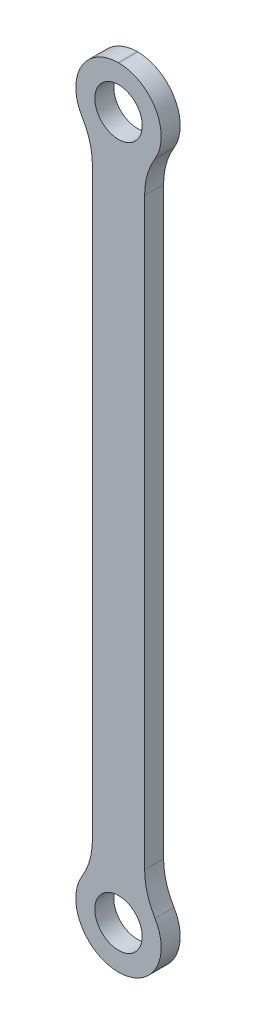
from build123d import *

# Parameters (mm, degrees)
SKETCH_1_R      = 5
EXTRUDE_1_DEPTH = 4


with BuildPart() as part:
    # 草图1 → 凸台-拉伸1 (new body)
    with BuildSketch(Plane.XY):
        with BuildLine():
            Line((-5.5, 135.520010959), (-5.5, 12.479983974))
            ThreePointArc((-5.5, 12.479983974), (-6.05722499, 8.429521038), (-7.6875, 4.67999399))
            ThreePointArc((-7.6875, 4.67999399), (-7.870390208, -4.365427582), (-0.099998457, -8.999444444))
            Line((-0.099998457, -8.999444444), (0.099998457, -8.999444444))
            ThreePointArc((0.099998457, -8.999444444), (7.870390208, -4.365427582), (7.6875, 4.67999399))
            ThreePointArc((7.6875, 4.67999399), (6.05722499, 8.429521038), (5.5, 12.479983974))
            Line((5.5, 12.479983974), (5.5, 135.520016026))
            ThreePointArc((5.5, 135.520016026), (6.05722499, 139.570478962), (7.6875, 143.32000601))
            ThreePointArc((7.6875, 143.32000601), (7.870390208, 152.365427582), (0.099998457, 156.999444444))
            Line((0.099998457, 156.999444444), (-0.099998457, 156.999444444))
            ThreePointArc((-0.099998457, 156.999444444), (-7.870390208, 152.365427582), (-7.6875, 143.32000601))
            ThreePointArc((-7.6875, 143.32000601), (-6.057224306, 139.570476523), (-5.5, 135.520010959))
        make_face()
        Circle(SKETCH_1_R, mode=Mode.SUBTRACT)
        with Locations((0, 148)):
            Circle(SKETCH_1_R, mode=Mode.SUBTRACT)
    extrude(amount=EXTRUDE_1_DEPTH)


solid = part.part
